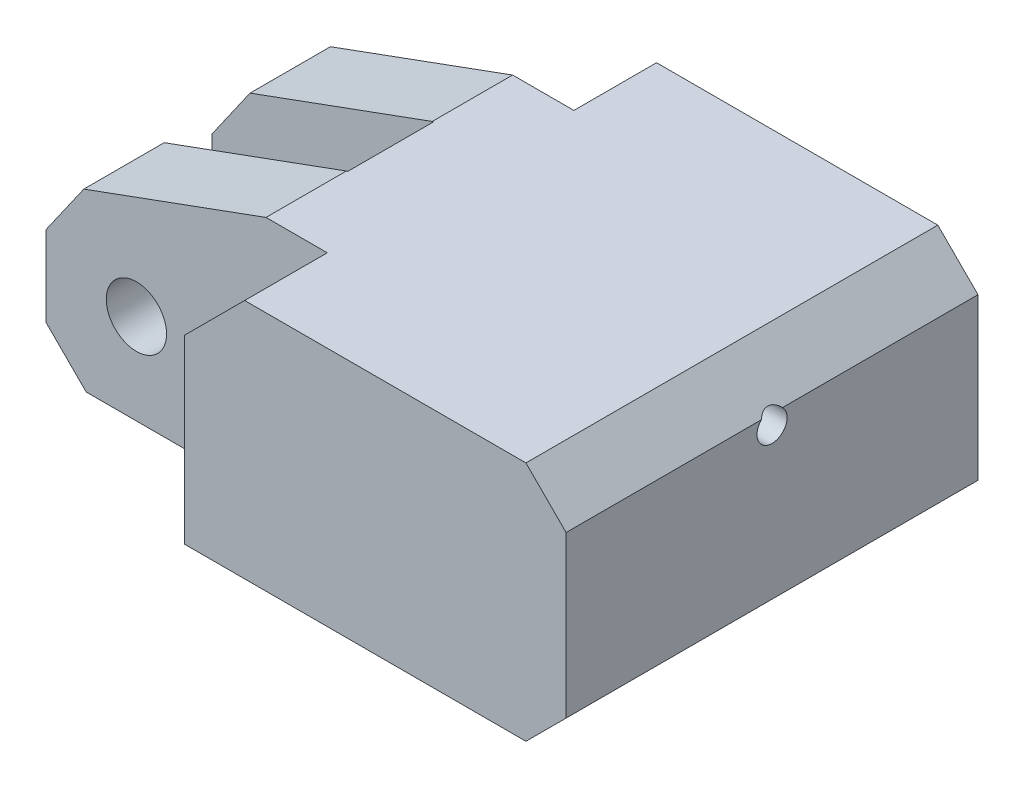
from build123d import *
from OCP.BRepFilletAPI import BRepFilletAPI_MakeChamfer

# Parameters (mm, degrees)
SKETCH_2_W          = 20.5
SKETCH_2_H          = 12
EXTRUDE_1_DEPTH     = 30
SKETCH_3_W          = 22
SKETCH_3_H          = 4.27428741
CUT_EXTRUDE_1_DEPTH = 34.897824414
SKETCH_10_W         = 17.106520138
SKETCH_10_H         = 9.063555791
CUT_EXTRUDE_3_DEPTH = 34.897824414
SKETCH_11_R         = 1.5
CUT_EXTRUDE_6_DEPTH = 35.706461629
SKETCH_12_R         = 0.75
CUT_EXTRUDE_4_DEPTH = 12
CUT_EXTRUDE_7_DEPTH = 37.827299657
CHAMFER_5_SIZE      = 2
CHAMFER_6_SIZE      = 2
CHAMFER_6_SIZE2     = 2.003351387
SKETCH_14_R         = 0.75
CUT_EXTRUDE_5_DEPTH = 23.406751215
CHAMFER_8_SIZE      = 3
CUT_EXTRUDE_8_DEPTH = 10


with BuildPart() as part:
    # Эскиз2 → Вытянуть1 (new body)
    with BuildSketch(Plane(origin=(0, 0, 0), x_dir=(0, 0, -1), z_dir=(1, 0, 0))):
        Rectangle(SKETCH_2_W, SKETCH_2_H)
    extrude(amount=EXTRUDE_1_DEPTH)

    # Эскиз3 → Вырез-Вытянуть1 (cut, through all)
    with BuildSketch(Plane(origin=(0, 6, 0), x_dir=(1, 0, 0), z_dir=(0, 1, 0))):
        Rectangle(SKETCH_3_W, SKETCH_3_H)
    extrude(amount=-CUT_EXTRUDE_1_DEPTH, mode=Mode.SUBTRACT)

    # Эскиз10 → Вырез-Вытянуть3 (cut, through all)
    with BuildSketch(Plane(origin=(0, 6, 0), x_dir=(1, 0, 0), z_dir=(0, 1, 0))):
        with Locations((2.446739931, 10.668921601)):
            Rectangle(SKETCH_10_W, SKETCH_10_H)
        with Locations((2.446739931, -10.668921601)):
            Rectangle(SKETCH_10_W, SKETCH_10_H)
    extrude(amount=-CUT_EXTRUDE_3_DEPTH, mode=Mode.SUBTRACT)

    # Эскиз11 → Вытянуть6 (cut, through all)
    with BuildSketch(Plane.XY.offset(6.137143705)):
        with Locations((4.5, -1.5)):
            Circle(SKETCH_11_R)
    extrude(amount=-CUT_EXTRUDE_6_DEPTH, mode=Mode.SUBTRACT)

    # Эскиз12 → Вырез-Вытянуть4 (cut)
    with BuildSketch(Plane.ZY.offset(-11)):
        with Locations((-1.791386219, -3.407348241)):
            Circle(SKETCH_12_R)
    extrude(amount=-CUT_EXTRUDE_4_DEPTH, mode=Mode.SUBTRACT)

    # Эскиз13 → Вытянуть7 (cut, through all)
    with BuildSketch(Plane.XY.offset(10.25)):
        Polygon((10.95, 6), (0, 6), (0, 2), align=None)
        Polygon((40.005782236, 6), (40.005782236, 2), (30.005782236, 6), align=None)
    extrude(amount=-CUT_EXTRUDE_7_DEPTH, mode=Mode.SUBTRACT)

    # Фаска5
    chamfer_5_edges = [part.edges().sort_by_distance(p)[0] for p in [
        (30, -6, 0),
        (0, -6, -4.137143705),
        (0, -6, 4.137143705),
        (30, 6, 0),
    ]]
    chamfer(chamfer_5_edges, length=CHAMFER_5_SIZE)

    # Фаска6: one chamfer whose edges measure the first distance from different faces: ONE call of the kernel's chamfer builder (chamfer() names one face for all edges)
    chamfer_6_edges_1 = [part.edges().sort_by_distance(p)[0] for p in [
        (0, 2, 4.137143705),
    ]]
    chamfer_6_side_1 = [part.faces().sort_by_distance(p)[0] for p in [
        (0, -1, 4.137143705),
    ]]
    chamfer_6_edges_2 = [part.edges().sort_by_distance(p)[0] for p in [
        (0, 2, -4.137143705),
    ]]
    chamfer_6_side_2 = [part.faces().sort_by_distance(p)[0] for p in [
        (0, -1, -4.137143705),
    ]]
    chamfer_6 = BRepFilletAPI_MakeChamfer(part.part.solid().wrapped)
    for e in chamfer_6_edges_1:
        chamfer_6.Add(CHAMFER_6_SIZE, CHAMFER_6_SIZE2, e.wrapped, chamfer_6_side_1[0].wrapped)  # the first distance lies on this face
    for e in chamfer_6_edges_2:
        chamfer_6.Add(CHAMFER_6_SIZE, CHAMFER_6_SIZE2, e.wrapped, chamfer_6_side_2[0].wrapped)  # the first distance lies on this face
    add(Compound.cast(chamfer_6.Shape()), mode=Mode.REPLACE)

    # Эскиз14 → Вырез-Вытянуть5 (cut, through all)
    with BuildSketch(Plane.ZY.offset(-11)):
        with Locations((0, 3.465363476)):
            Circle(SKETCH_14_R)
    extrude(amount=-CUT_EXTRUDE_5_DEPTH, mode=Mode.SUBTRACT)

    # Фаска8
    chamfer_8_edges = [part.edges().sort_by_distance(p)[0] for p in [
        (11, 6, -8.193571852),
        (11, 6, 8.193571852),
    ]]
    chamfer(chamfer_8_edges, length=CHAMFER_8_SIZE)

    # Эскиз15 → Вытянуть8 (cut)
    with BuildSketch(Plane.XZ.offset(6)):
        with BuildLine():
            Line((16, 6.25), (25, 6.25))
            ThreePointArc((25, 6.25), (26.414213562, 5.664213562), (27, 4.25))
            Line((27, 4.25), (27, -4.25))
            ThreePointArc((27, -4.25), (26.414213562, -5.664213562), (25, -6.25))
            Line((25, -6.25), (16, -6.25))
            ThreePointArc((16, -6.25), (14.585786438, -5.664213562), (14, -4.25))
            Line((14, -4.25), (14, 4.25))
            ThreePointArc((14, 4.25), (14.585786438, 5.664213562), (16, 6.25))
        make_face()
    extrude(amount=-CUT_EXTRUDE_8_DEPTH, mode=Mode.SUBTRACT)


solid = part.part
